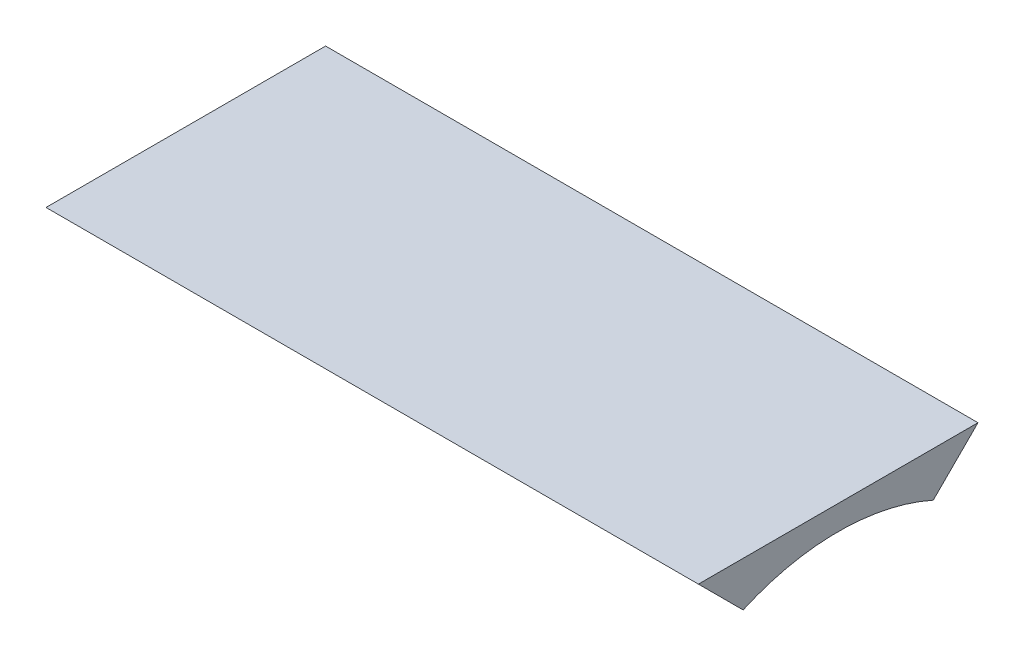
from build123d import *

# Parameters (mm, degrees)
EXTRUDE_1_DEPTH = 70


with BuildPart() as part:
    # Эскиз1 → Бобышка-Вытянуть1 (new body)
    with BuildSketch(Plane(origin=(0, 0, 0), x_dir=(0, 0, -1), z_dir=(1, 0, 0))):
        with BuildLine():
            Line((-15, 27.624548188), (-10.2, 22.824548188))
            ThreePointArc((-10.2, 22.824548188), (0, 25), (10.2, 22.824548188))
            Line((10.2, 22.824548188), (15, 27.624548188))
            Line((15, 27.624548188), (-15, 27.624548188))
        make_face()
    extrude(amount=EXTRUDE_1_DEPTH)


solid = part.part
